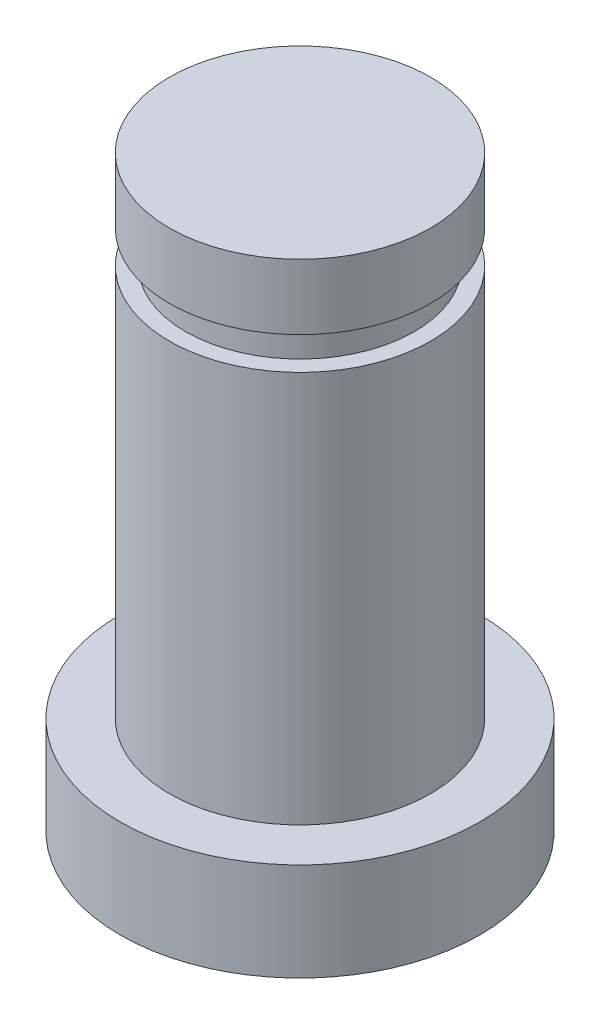
from build123d import *

# Parameters (mm, degrees)
SKETCH1_R           = 5.08
BOSS_EXTRUDE1_DEPTH = 15.24
SKETCH4_R           = 4.445
BOSS_EXTRUDE4_DEPTH = 1.27
SKETCH5_R           = 5.08
BOSS_EXTRUDE5_DEPTH = 2.54
SKETCH6_R           = 6.985
BOSS_EXTRUDE8_DEPTH = 3.81


with BuildPart() as part:
    # Sketch1 → Boss-Extrude1 (new body)
    with BuildSketch(Plane(origin=(0, 0, 0), x_dir=(1, 0, 0), z_dir=(0, 1, 0))):
        with Locations(Location((0, 0, 0), (0, 0, 90))):
            Circle(SKETCH1_R)
    extrude(amount=BOSS_EXTRUDE1_DEPTH)

    # Sketch4 → Boss-Extrude4 (add)
    with BuildSketch(Plane(origin=(0, 15.24, 0), x_dir=(1, 0, 0), z_dir=(0, 1, 0))):
        with Locations(Location((0, 0, 0), (0, 0, 270))):
            Circle(SKETCH4_R)
    extrude(amount=BOSS_EXTRUDE4_DEPTH)

    # Sketch5 → Boss-Extrude5 (add)
    with BuildSketch(Plane(origin=(0, 16.51, 0), x_dir=(1, 0, 0), z_dir=(0, 1, 0))):
        with Locations(Location((0, 0, 0), (0, 0, 90))):
            Circle(SKETCH5_R)
    extrude(amount=BOSS_EXTRUDE5_DEPTH)

    # Sketch6 → Boss-Extrude8 (add)
    with BuildSketch(Plane.XZ):
        with Locations(Location((0, 0, 0), (0, 0, 90))):
            Circle(SKETCH6_R)
    extrude(amount=BOSS_EXTRUDE8_DEPTH)


solid = part.part
